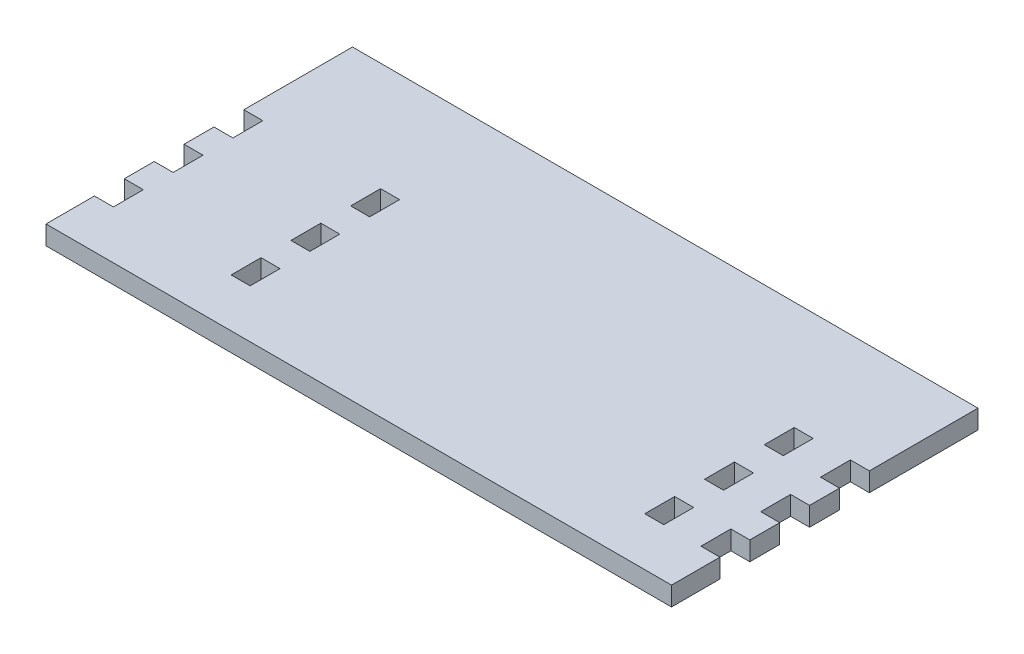
from build123d import *

# Parameters (mm, degrees)
SKETCH1_W           = 3.175
SKETCH1_H           = 5
BOSS_EXTRUDE1_DEPTH = 3.175


with BuildPart() as part:
    # Sketch1 → Boss-Extrude1 (new body)
    with BuildSketch(Plane(origin=(0, 0, 0), x_dir=(1, 0, 0), z_dir=(0, 1, 0))):
        Polygon((-104.648, -5), (-101.473, -5), (-101.473, -10), (-104.648, -10), (-104.648, -15), (-101.473, -15), (-101.473, -20), (-104.648, -20), (-104.648, -25), (-101.473, -25), (-101.473, -30), (-104.648, -30), (-104.648, -38.1), (-101.473, -38.1), (-3.175, -38.1), (0, -38.1), (0, -30), (-3.175, -30), (-3.175, -25), (0, -25), (0, -20), (-3.175, -20), (-3.175, -15), (0, -15), (0, -10), (-3.175, -10), (-3.175, -5), (0, -5), (0, 0), (0, 3.175), (0, 13.175), (-104.648, 13.175), (-104.648, 3.175), (-104.648, 0), align=None)
        with Locations((-80.186500028, -7.5)):
            Rectangle(SKETCH1_W, SKETCH1_H, mode=Mode.SUBTRACT)
        with Locations((-80.186500028, -17.5)):
            Rectangle(SKETCH1_W, SKETCH1_H, mode=Mode.SUBTRACT)
        with Locations((-80.186500028, -27.5)):
            Rectangle(SKETCH1_W, SKETCH1_H, mode=Mode.SUBTRACT)
        with Locations((-10.9855, -27.5)):
            Rectangle(SKETCH1_W, SKETCH1_H, mode=Mode.SUBTRACT)
        with Locations((-10.9855, -17.5)):
            Rectangle(SKETCH1_W, SKETCH1_H, mode=Mode.SUBTRACT)
        with Locations((-10.9855, -7.5)):
            Rectangle(SKETCH1_W, SKETCH1_H, mode=Mode.SUBTRACT)
    extrude(amount=BOSS_EXTRUDE1_DEPTH)


solid = part.part
